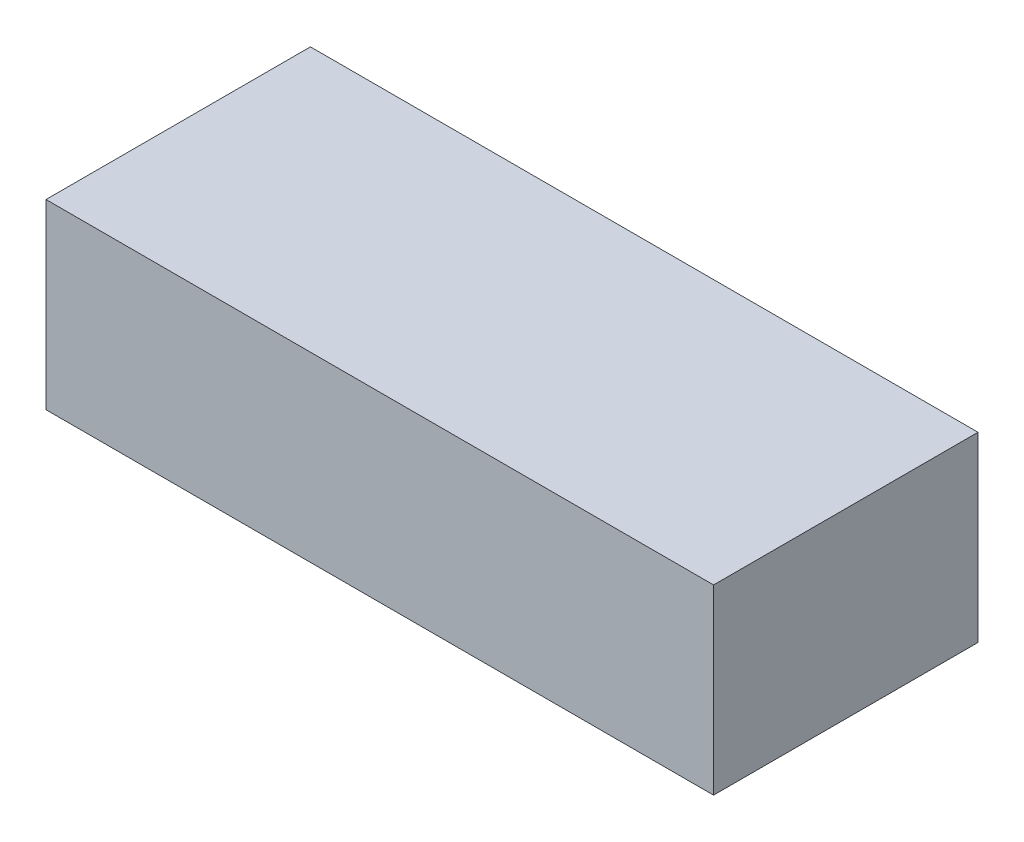
from build123d import *

# Parameters (mm, degrees)
SKETCH_1_W      = 77
SKETCH_1_H      = 30.5
EXTRUDE_1_DEPTH = 21


with BuildPart() as part:
    # 草图1 → 凸台-拉伸1 (new body)
    with BuildSketch(Plane(origin=(0, 0, 0), x_dir=(1, 0, 0), z_dir=(0, 1, 0))):
        Rectangle(SKETCH_1_W, SKETCH_1_H)
    extrude(amount=EXTRUDE_1_DEPTH)


solid = part.part
